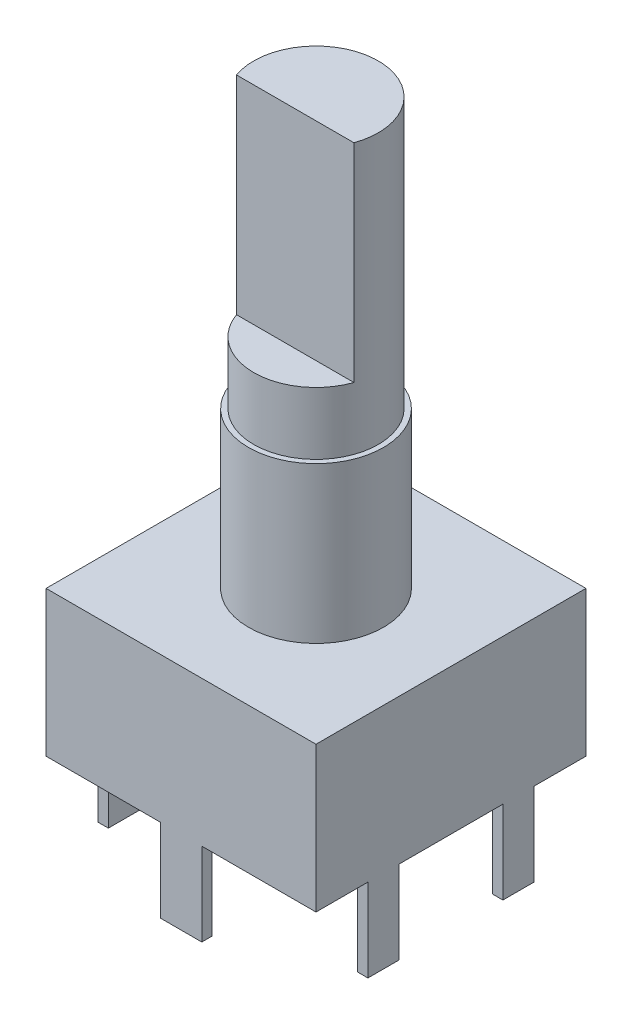
from build123d import *

# Parameters (mm, degrees)
SKETCH1_W             = 12
SKETCH1_H             = 12
BOSS_EXTRUDE1_DEPTH   = 7
SKETCH2_W             = 0.5
SKETCH2_H             = 1.5
BOSS_EXTRUDE2_DEPTH   = 4
SKETCH2_W_2           = 2
SKETCH2_H_2           = 0.5
BOSS_EXTRUDE2_2_DEPTH = 4
BOSS_EXTRUDE2_3_DEPTH = 4
BOSS_EXTRUDE2_4_DEPTH = 4
BOSS_EXTRUDE2_5_DEPTH = 4
BOSS_EXTRUDE2_6_DEPTH = 4
BOSS_EXTRUDE2_7_DEPTH = 4
SKETCH3_W             = 13
SKETCH3_H             = 13
SKETCH3_W_2           = 12
SKETCH3_H_2           = 12
BOSS_EXTRUDE3_DEPTH   = 7
SKETCH4_R             = 3.25
BOSS_EXTRUDE4_DEPTH   = 7.5
SKETCH5_R             = 3
BOSS_EXTRUDE5_DEPTH   = 13
CUT_EXTRUDE1_START    = -10
CUT_EXTRUDE1_DEPTH    = 10


with BuildPart() as part:
    # Sketch1 → Boss-Extrude1 (new body)
    with BuildSketch(Plane(origin=(0, 0, 0), x_dir=(1, 0, 0), z_dir=(0, 1, 0))):
        with Locations((-6, -6)):
            Rectangle(SKETCH1_W, SKETCH1_H)
    extrude(amount=BOSS_EXTRUDE1_DEPTH)



with BuildPart() as body_2:
    # Sketch2 → Boss-Extrude2 (new body)
    with BuildSketch(Plane.XZ):
        with Locations((-12.25, 9.25)):
            Rectangle(SKETCH2_W, SKETCH2_H)
    extrude(amount=BOSS_EXTRUDE2_DEPTH)


with BuildPart() as body_3:
    # Sketch2 → Boss-Extrude2 2 (new body)
    with BuildSketch(Plane.XZ):
        with Locations((-6, -0.25)):
            Rectangle(SKETCH2_W_2, SKETCH2_H_2)
    extrude(amount=BOSS_EXTRUDE2_2_DEPTH)


with BuildPart() as body_4:
    # Sketch2 → Boss-Extrude2 3 (new body)
    with BuildSketch(Plane.XZ):
        with Locations((0.25, 2.75)):
            Rectangle(SKETCH2_W, SKETCH2_H)
    extrude(amount=BOSS_EXTRUDE2_3_DEPTH)


with BuildPart() as body_5:
    # Sketch2 → Boss-Extrude2 4 (new body)
    with BuildSketch(Plane.XZ):
        with Locations((-6, 12.25)):
            Rectangle(SKETCH2_W_2, SKETCH2_H_2)
    extrude(amount=BOSS_EXTRUDE2_4_DEPTH)


with BuildPart() as body_6:
    # Sketch2 → Boss-Extrude2 5 (new body)
    with BuildSketch(Plane.XZ):
        with Locations((-12.25, 6.043)):
            Rectangle(SKETCH2_W, SKETCH2_H)
    extrude(amount=BOSS_EXTRUDE2_5_DEPTH)


with BuildPart() as body_7:
    # Sketch2 → Boss-Extrude2 6 (new body)
    with BuildSketch(Plane.XZ):
        with Locations((-12.25, 2.75)):
            Rectangle(SKETCH2_W, SKETCH2_H)
    extrude(amount=BOSS_EXTRUDE2_6_DEPTH)


with BuildPart() as body_8:
    # Sketch2 → Boss-Extrude2 7 (new body)
    with BuildSketch(Plane.XZ):
        with Locations((0.25, 9.25)):
            Rectangle(SKETCH2_W, SKETCH2_H)
    extrude(amount=BOSS_EXTRUDE2_7_DEPTH)


with BuildPart() as part_1:
    add(part.part)

    add(body_2.part)  # Boss-Extrude3 merges body 2

    add(body_3.part)  # Boss-Extrude3 merges body 3

    add(body_4.part)  # Boss-Extrude3 merges body 4

    add(body_5.part)  # Boss-Extrude3 merges body 5

    add(body_6.part)  # Boss-Extrude3 merges body 6

    add(body_7.part)  # Boss-Extrude3 merges body 7

    add(body_8.part)  # Boss-Extrude3 merges body 8
    # Sketch3 → Boss-Extrude3 (add)
    with BuildSketch(Plane(origin=(0, 7, 0), x_dir=(1, 0, 0), z_dir=(0, 1, 0))):
        with Locations((-6, -6)):
            Rectangle(SKETCH3_W, SKETCH3_H)
        with Locations((-6, -6)):
            Rectangle(SKETCH3_W_2, SKETCH3_H_2, mode=Mode.SUBTRACT)
    extrude(amount=-BOSS_EXTRUDE3_DEPTH)

    # Sketch4 → Boss-Extrude4 (add)
    with BuildSketch(Plane(origin=(0, 7, 0), x_dir=(1, 0, 0), z_dir=(0, 1, 0))):
        with Locations(Location((-6, -6, 0), (0, 0, 270))):
            Circle(SKETCH4_R)
    extrude(amount=BOSS_EXTRUDE4_DEPTH)

    # Sketch5 → Boss-Extrude5 (add)
    with BuildSketch(Plane(origin=(0, 14.5, 0), x_dir=(1, 0, 0), z_dir=(0, 1, 0))):
        with Locations(Location((-6, -6, 0), (0, 0, 90))):
            Circle(SKETCH5_R)
    extrude(amount=BOSS_EXTRUDE5_DEPTH)

    # Sketch6 → Cut-Extrude1 (cut)
    with BuildSketch(Plane(origin=(0, 27.5, 0), x_dir=(1, 0, 0), z_dir=(0, 1, 0)).offset(CUT_EXTRUDE1_START)):
        with BuildLine():
            Line((-8.828427125, -7), (-3.171572875, -7))
            ThreePointArc((-3.171572875, -7), (-6, -9), (-8.828427125, -7))
        make_face()
    extrude(amount=CUT_EXTRUDE1_DEPTH, mode=Mode.SUBTRACT)


solid = part_1.part
